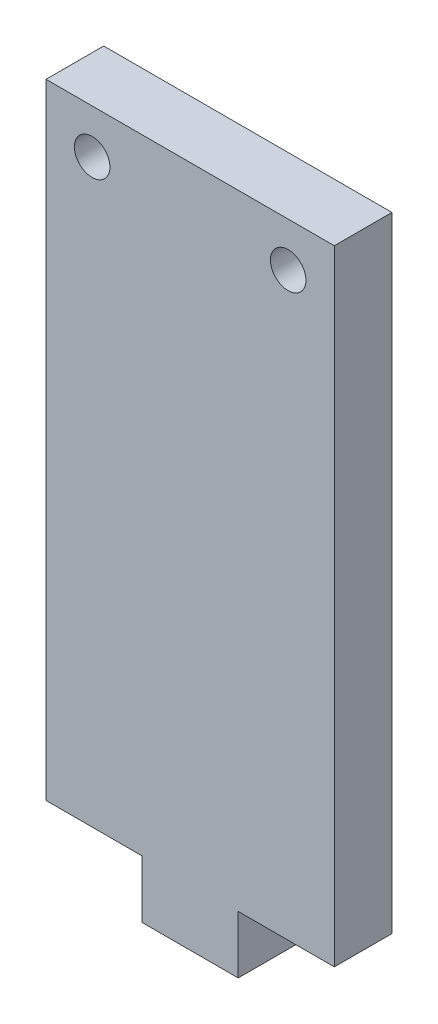
from build123d import *

# Parameters (mm, degrees)
ESQUISSE1_W             = 30
ESQUISSE1_H             = 71
BOSS_EXTRU_1_DEPTH      = 6
ESQUISSE3_R             = 1.85
ESQUISSE3_W             = 10
ESQUISSE3_H             = 6
ENL_V_MAT_EXTRU_1_DEPTH = 6


with BuildPart() as part:
    # Esquisse1 → Boss.-Extru.1 (new body)
    with BuildSketch(Plane.XY):
        with Locations((-15, 35.5)):
            Rectangle(ESQUISSE1_W, ESQUISSE1_H)
    extrude(amount=BOSS_EXTRU_1_DEPTH)

    # Esquisse3 → Enlèv. mat.-Extru.1 (cut)
    with BuildSketch(Plane(origin=(0, 0, 0), x_dir=(-1, 0, 0), z_dir=(0, 0, -1))):
        with Locations((4.8, 66.4)):
            Circle(ESQUISSE3_R)
        with Locations((25.2, 66.4)):
            Circle(ESQUISSE3_R)
        with Locations((5, 3)):
            Rectangle(ESQUISSE3_W, ESQUISSE3_H)
        with Locations((25, 3)):
            Rectangle(ESQUISSE3_W, ESQUISSE3_H)
    extrude(amount=-ENL_V_MAT_EXTRU_1_DEPTH, mode=Mode.SUBTRACT)


solid = part.part
